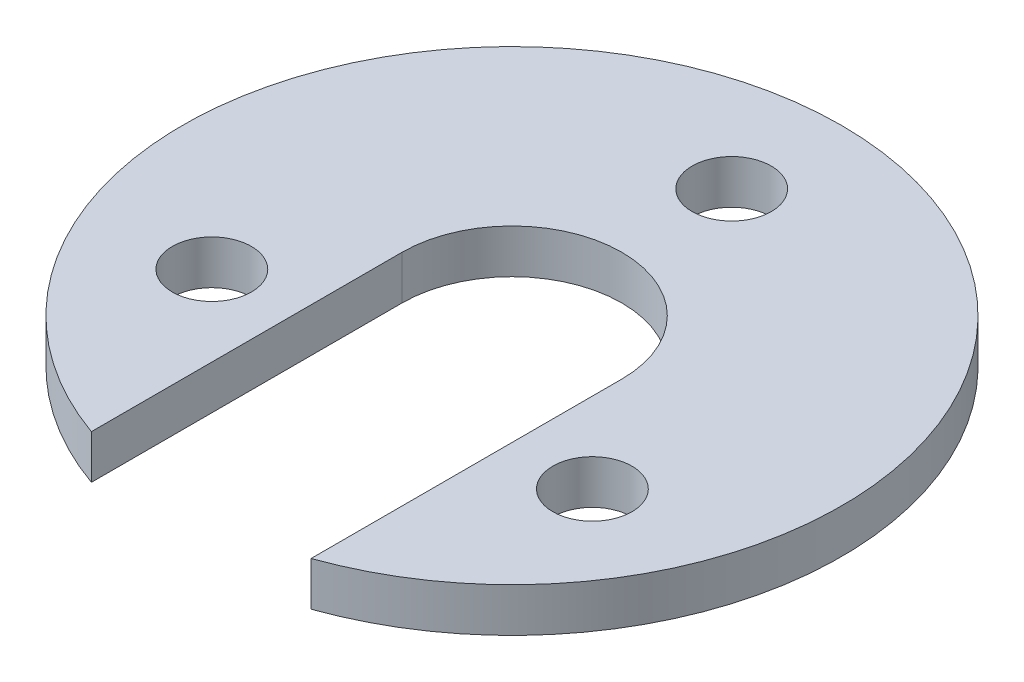
from build123d import *

# Parameters (mm, degrees)
SKETCH1_R           = 9
BOSS_EXTRUDE1_DEPTH = 10


with BuildPart() as part:
    # Sketch1 → Boss-Extrude1 (new body)
    with BuildSketch(Plane(origin=(0, 0, 0), x_dir=(1, 0, 0), z_dir=(0, 1, 0))):
        with BuildLine():
            Line((25, 0), (25, -70.710678119))
            ThreePointArc((25, -70.710678119), (0, 75), (-25, -70.710678119))
            Line((-25, -70.710678119), (-25, 0))
            ThreePointArc((-25, 0), (0, 25), (25, 0))
        make_face()
        with Locations(Location((0, 50, 0), (0, 0, 270))):
            Circle(SKETCH1_R, mode=Mode.SUBTRACT)
        with Locations(Location((43.301270189, -25, 0), (0, 0, 270))):
            Circle(SKETCH1_R, mode=Mode.SUBTRACT)
        with Locations(Location((-43.301270189, -25, 0), (0, 0, 270))):
            Circle(SKETCH1_R, mode=Mode.SUBTRACT)
    extrude(amount=BOSS_EXTRUDE1_DEPTH)


solid = part.part
